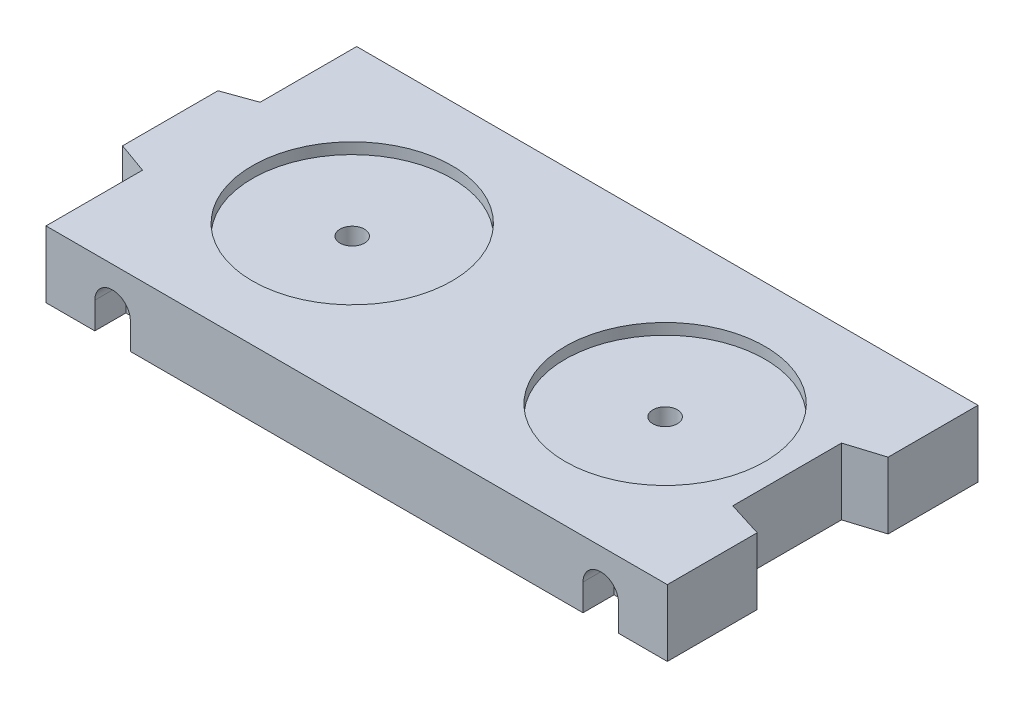
from build123d import *

# Parameters (mm, degrees)
ESTRUSIONE1_DEPTH                                    = 30
ESTRUSIONE2_DEPTH                                    = 14
RIPETIZIONE_A_L1_COUNT                               = 2
RIPETIZIONE_A_L1_PITCH                               = 220
RIPETIZIONE_A_L1_COUNT_DIR2                          = 2
RIPETIZIONE_A_L1_PITCH_DIR2                          = 126
SCHIZZO3_R                                           = 45
ESTRUSIONE3_DEPTH                                    = 5
M10_LAMATURA_PER_VITE_A_COPERTURA_CILIND_D           = 11
M10_LAMATURA_PER_VITE_A_COPERTURA_CILIND_CBORE_D     = 18
M10_LAMATURA_PER_VITE_A_COPERTURA_CILIND_CBORE_DEPTH = 10
M10_TAPPED_HOLE1_D                                   = 8.5
M10_TAPPED_HOLE1_DEPTH                               = 25
M10_TAPPED_HOLE1_TIP                                 = 2.553657631


with BuildPart() as part:
    # Schizzo1 → Estrusione1 (new body)
    with BuildSketch(Plane(origin=(0, 0, 0), x_dir=(1, 0, 0), z_dir=(0, 1, 0))):
        Polygon((-14, 91.5), (-14, 48.5), (0, 43.5), (0, 0), (280, 0), (280, 40.5), (264, 45.5), (264, 94.5), (280, 99.5), (280, 140), (0, 140), (0, 96.5), align=None)
    extrude(amount=ESTRUSIONE1_DEPTH)

    # Schizzo2 → Estrusione2 (cut)
    with BuildSketch(Plane.XY):
        with BuildLine():
            Line((22, 12), (22, 0))
            Line((22, 0), (38, 0))
            Line((38, 0), (38, 12))
            ThreePointArc((38, 12), (30, 20), (22, 12))
        make_face()
    estrusione2 = extrude(amount=-ESTRUSIONE2_DEPTH, mode=Mode.SUBTRACT)

    # Ripetizione a L1: Estrusione2 2 × 2
    with Locations(*[(i * RIPETIZIONE_A_L1_PITCH, 0, -j * RIPETIZIONE_A_L1_PITCH_DIR2) for i in range(RIPETIZIONE_A_L1_COUNT) for j in range(RIPETIZIONE_A_L1_COUNT_DIR2) if (i, j) != (0, 0)]):
        add(estrusione2, mode=Mode.SUBTRACT)

    # Schizzo3 → Estrusione3 (cut)
    with BuildSketch(Plane(origin=(0, 30, 0), x_dir=(1, 0, 0), z_dir=(0, 1, 0))):
        with Locations(Location((68, 70, 0), (0, 0, 270))):
            Circle(SCHIZZO3_R)
        with Locations(Location((209, 70, 0), (0, 0, 270))):
            Circle(SCHIZZO3_R)
    extrude(amount=-ESTRUSIONE3_DEPTH, mode=Mode.SUBTRACT)

    # M10 Lamatura per vite a copertura cilindrica esagonale2 (through all)
    with Locations(Plane.XZ):
        with Locations((68, -70), (209, -70)):
            CounterBoreHole(M10_LAMATURA_PER_VITE_A_COPERTURA_CILIND_D / 2, M10_LAMATURA_PER_VITE_A_COPERTURA_CILIND_CBORE_D / 2, M10_LAMATURA_PER_VITE_A_COPERTURA_CILIND_CBORE_DEPTH)

    # M10 Tapped Hole1
    with Locations(Plane.XZ):
        with Locations((93.5, -25), (183.5, -25), (93.5, -115), (183.5, -115)):
            Hole(M10_TAPPED_HOLE1_D / 2, depth=M10_TAPPED_HOLE1_DEPTH)
            with Locations((0, 0, -(M10_TAPPED_HOLE1_DEPTH + M10_TAPPED_HOLE1_TIP / 2))):  # 118° drill point
                Cone(0, M10_TAPPED_HOLE1_D / 2, M10_TAPPED_HOLE1_TIP, mode=Mode.SUBTRACT)


solid = part.part
